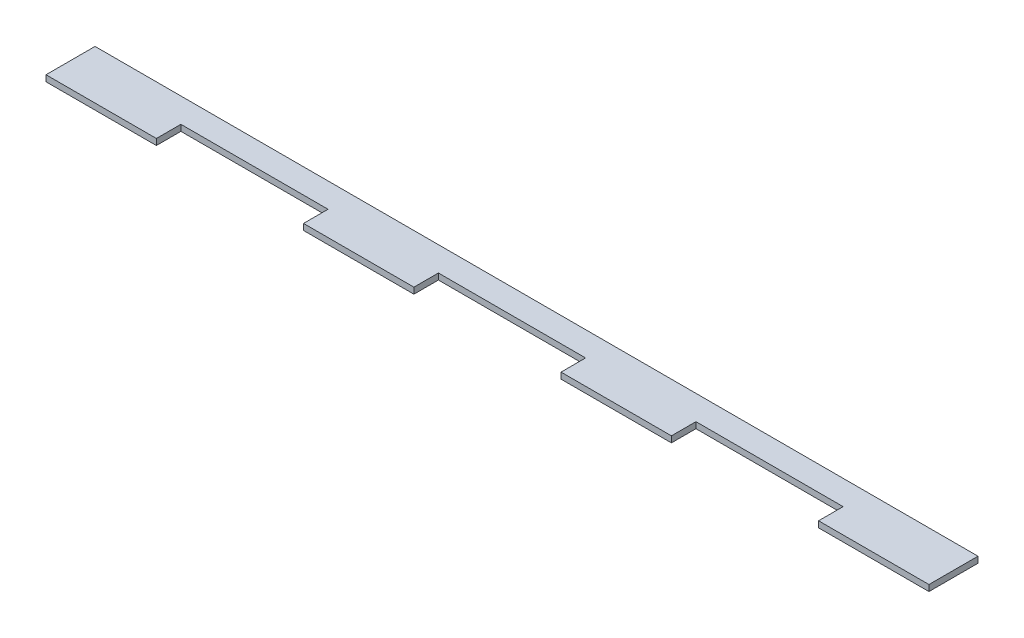
from build123d import *

# Parameters (mm, degrees)
SKETCH1_W           = 1828.8
SKETCH1_H           = 101.6
BOSS_EXTRUDE1_DEPTH = 12.7
CUT_EXTRUDE1_DEPTH  = 12.7


with BuildPart() as part:
    # Sketch1 → Boss-Extrude1 (new body)
    with BuildSketch(Plane(origin=(0, 0, 0), x_dir=(1, 0, 0), z_dir=(0, 1, 0))):
        with Locations((874.865206316, 17.108399093)):
            Rectangle(SKETCH1_W, SKETCH1_H)
    extrude(amount=BOSS_EXTRUDE1_DEPTH)

    # Sketch2 → Cut-Extrude1 (cut)
    with BuildSketch(Plane(origin=(0, 12.7, 0), x_dir=(1, 0, 0), z_dir=(0, 1, 0))):
        Polygon((341.465206316, -33.691600907), (189.065206316, -33.691600907), (189.065206316, 17.108399093), (493.865206316, 17.108399093), (493.865206316, -33.691600907), align=None)
        Polygon((1408.265206316, -33.691600907), (1255.865206316, -33.691600907), (1255.865206316, 17.108399093), (1560.665206316, 17.108399093), (1560.665206316, -33.691600907), align=None)
        Polygon((874.865206316, -33.691600907), (722.465206316, -33.691600907), (722.465206316, 17.108399093), (1027.265206316, 17.108399093), (1027.265206316, -33.691600907), align=None)
    extrude(amount=-CUT_EXTRUDE1_DEPTH, mode=Mode.SUBTRACT)


solid = part.part
